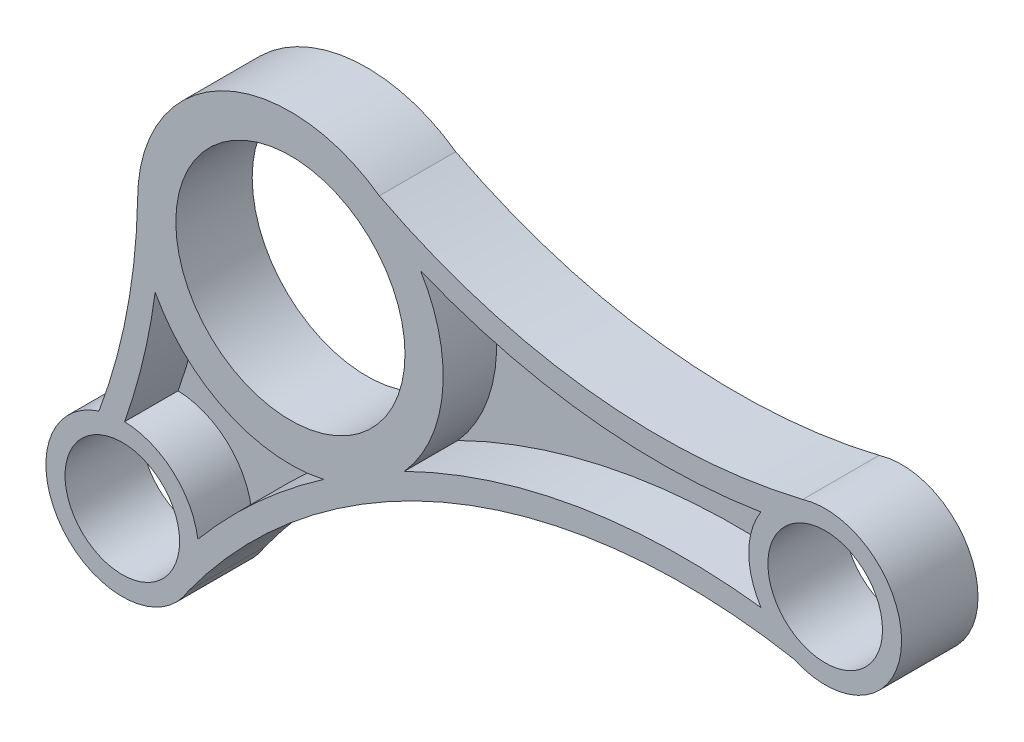
from build123d import *

# Parameters (mm, degrees)
SKETCH3_R           = 20
SKETCH3_R_2         = 15
SKETCH3_R_3         = 10
SKETCH3_R_4         = 7.5
BOSS_EXTRUDE1_DEPTH = 10
BOSS_EXTRUDE3_DEPTH = 3


with BuildPart() as part:
    # Sketch3 → Boss-Extrude1 (new body)
    # profile 1 of 6: a face of its own
    with BuildSketch(Plane.XY):
        with BuildLine():
            ThreePointArc((93.599540264, 15.920778558), (128.582431805, 43.32581827), (172.792265807, 47.834640706))
            ThreePointArc((172.792265807, 47.834640706), (170.402615718, 49.368900415), (168.540603284, 51.513029633))
            ThreePointArc((168.540603284, 51.513029633), (144.624934442, 50.959037098), (121.8606014, 43.607080548))
            ThreePointArc((121.8606014, 43.607080548), (117.069520627, 39.683138814), (111.307748037, 37.412951524))
            ThreePointArc((111.307748037, 37.412951524), (102.56627164, 30.460503982), (94.837400467, 22.39734785))
            ThreePointArc((94.837400467, 22.39734785), (94.918388119, 21.666366387), (94.945432764, 20.931409595))
            ThreePointArc((94.945432764, 20.931409595), (94.603100055, 18.337288838), (93.599540264, 15.920778558))
        make_face()
    # profile 2 of 6: a face of its own
    with BuildSketch(Plane.XY):
        with BuildLine():
            ThreePointArc((89.245155024, 47.620117101), (87.528873404, 52.135867645), (86.945432764, 56.931409595))
            ThreePointArc((86.945432764, 56.931409595), (85.538303333, 43.476636452), (81.884211959, 30.451332241))
            ThreePointArc((81.884211959, 30.451332241), (83.546001392, 30.833005014), (85.248475349, 30.9268168))
            ThreePointArc((85.248475349, 30.9268168), (87.679513668, 39.169871065), (89.245155024, 47.620117101))
        make_face()
    # profile 3 of 6: a face of its own
    with BuildSketch(Plane.XY):
        with BuildLine():
            ThreePointArc((168.529854034, 62.33307921), (170.898087492, 64.895680758), (174.002612838, 66.488595942))
            ThreePointArc((174.002612838, 66.488595942), (145.688050003, 64.85214344), (118.581891775, 73.197719001))
            ThreePointArc((118.581891775, 73.197719001), (121.570888747, 70.573111736), (123.981351449, 67.408884223))
            ThreePointArc((123.981351449, 67.408884223), (145.906367795, 61.805873057), (168.529854034, 62.33307921))
        make_face()
    # profile 4 of 6: a face of its own
    with BuildSketch(Plane.XY):
        with Locations((106.945432764, 56.931409595)):
            Circle(SKETCH3_R)
        with Locations((106.945432764, 56.931409595)):
            Circle(SKETCH3_R_2, mode=Mode.SUBTRACT)
    # profile 5 of 6: a face of its own
    with BuildSketch(Plane.XY):
        with Locations((84.945432764, 20.931409595)):
            Circle(SKETCH3_R_3)
        with Locations((84.945432764, 20.931409595)):
            Circle(SKETCH3_R_4, mode=Mode.SUBTRACT)
    # profile 6 of 6: a face of its own
    with BuildSketch(Plane.XY):
        with Locations((176.945432764, 56.931409595)):
            Circle(SKETCH3_R_3)
        with Locations((176.945432764, 56.931409595)):
            Circle(SKETCH3_R_4, mode=Mode.SUBTRACT)
    extrude(amount=BOSS_EXTRUDE1_DEPTH)

    # Sketch4 → Boss-Extrude3 (add)
    with BuildSketch(Plane.XY):
        with BuildLine():
            ThreePointArc((94.837400467, 22.39734785), (91.59167372, 28.403188577), (85.248475349, 30.9268168))
            ThreePointArc((85.248475349, 30.9268168), (87.679513668, 39.169871065), (89.245155024, 47.620117101))
            ThreePointArc((89.245155024, 47.620117101), (98.547702834, 38.779877097), (111.307748037, 37.412951524))
            ThreePointArc((111.307748037, 37.412951524), (102.56627164, 30.460503982), (94.837400467, 22.39734785))
        make_face()
        with BuildLine():
            ThreePointArc((168.529854034, 62.33307921), (166.945437699, 56.921475033), (168.540603284, 51.513029633))
            ThreePointArc((168.540603284, 51.513029633), (144.624934442, 50.959037098), (121.8606014, 43.607080548))
            ThreePointArc((121.8606014, 43.607080548), (126.866513553, 55.156433479), (123.981351449, 67.408884223))
            ThreePointArc((123.981351449, 67.408884223), (145.906367795, 61.805873057), (168.529854034, 62.33307921))
        make_face()
    extrude(amount=BOSS_EXTRUDE3_DEPTH)


solid = part.part
